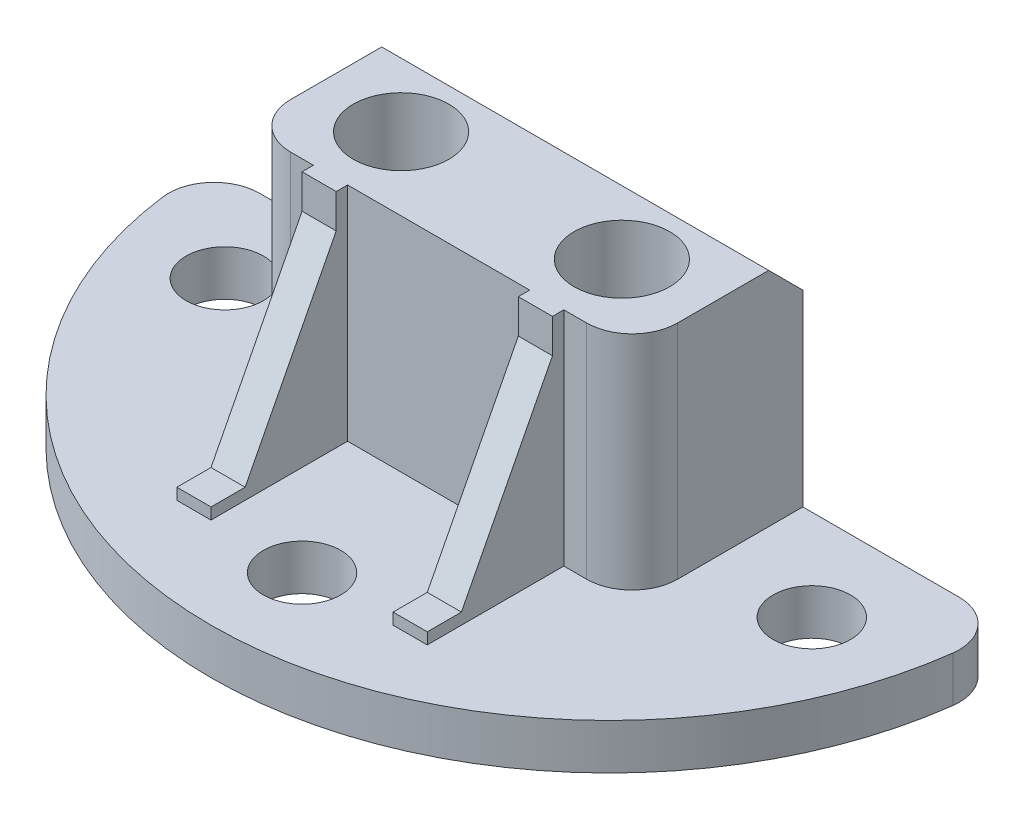
from build123d import *

# Parameters (mm, degrees)
BOSS_EXTRUDE1_DEPTH = 2
SKETCH1_3_W         = 17
SKETCH1_3_H         = 7.5
SKETCH1_3_R         = 2.1
BOSS_EXTRUDE2_DEPTH = 11.75
FILLET1_R           = 2
CHAMFER1_SIZE       = 1.5
SKETCH2_W           = 1.5
SKETCH2_H           = 9.75
BOSS_EXTRUDE3_DEPTH = 6
CUT_EXTRUDE1_DEPTH  = 32.102554433
CUT_EXTRUDE2_START  = 11.75
SKETCH1_4_R         = 2.1
CUT_EXTRUDE2_DEPTH  = 5


with BuildPart() as part:
    # Sketch1 → Boss-Extrude1 (new body)
    with BuildSketch(Plane(origin=(0, 0, 0), x_dir=(1, 0, 0), z_dir=(0, 1, 0))):
        with BuildLine():
            ThreePointArc((13.294270592, -2.34784357), (13.448469299, -1.178419919), (13.5, 0))
            Line((13.5, 0), (8.5, 0))
            Line((8.5, 0), (8.5, -7.5))
            Line((8.5, -7.5), (-8.5, -7.5))
            Line((-8.5, -7.5), (-8.5, 0))
            Line((-8.5, 0), (-13.5, 0))
            ThreePointArc((-13.5, 0), (-13.448469299, -1.178419919), (-13.294270592, -2.34784357))
            ThreePointArc((-13.294270592, -2.34784357), (-11.842798665, -2.663810422), (-11.193796958, -4))
            ThreePointArc((-11.193796958, -4), (-11.494084595, -4.964782515), (-12.288862018, -5.588727075))
            ThreePointArc((-12.288862018, -5.588727075), (-8.007808689, -10.86853256), (-1.696626969, -13.392962963))
            ThreePointArc((-1.696626969, -13.392962963), (0, -11.8), (1.696626969, -13.392962963))
            ThreePointArc((1.696626969, -13.392962963), (8.007808689, -10.86853256), (12.288862018, -5.588727075))
            ThreePointArc((12.288862018, -5.588727075), (11.270133638, -3.496296296), (13.294270592, -2.34784357))
        make_face()
        with BuildLine():
            Line((17.5, 0), (13.5, 0))
            ThreePointArc((13.5, 0), (13.448469299, -1.178419919), (13.294270592, -2.34784357))
            ThreePointArc((13.294270592, -2.34784357), (14.229986536, -2.949001707), (14.593796958, -4))
            ThreePointArc((14.593796958, -4), (13.858579473, -5.399712363), (12.288862018, -5.588727075))
            ThreePointArc((12.288862018, -5.588727075), (8.007808689, -10.86853256), (1.696626969, -13.392962963))
            ThreePointArc((1.696626969, -13.392962963), (1.699156533, -13.446454915), (1.7, -13.5))
            ThreePointArc((1.7, -13.5), (-0.053545085, -15.199156533), (-1.696626969, -13.392962963))
            ThreePointArc((-1.696626969, -13.392962963), (-8.007808689, -10.86853256), (-12.288862018, -5.588727075))
            ThreePointArc((-12.288862018, -5.588727075), (-14.517460279, -4.503703704), (-13.294270592, -2.34784357))
            ThreePointArc((-13.294270592, -2.34784357), (-13.448469299, -1.178419919), (-13.5, 0))
            Line((-13.5, 0), (-17.5, 0))
            ThreePointArc((-17.5, 0), (0, -17.5), (17.5, 0))
        make_face()
    extrude(amount=BOSS_EXTRUDE1_DEPTH)

    # Sketch1<3> → Boss-Extrude2 (add)
    # profile 1 of 3: a face of its own
    with BuildSketch(Plane(origin=(0, 0, 0), x_dir=(1, 0, 0), z_dir=(0, 1, 0))):
        with Locations((0, -3.75)):
            Rectangle(SKETCH1_3_W, SKETCH1_3_H)
        with Locations((-4.85, -4.3)):
            Circle(SKETCH1_3_R, mode=Mode.SUBTRACT)
        with Locations((4.85, -4.3)):
            Circle(SKETCH1_3_R, mode=Mode.SUBTRACT)
    # profile 2 of 3: a face of its own
    with BuildSketch(Plane(origin=(0, 0, 0), x_dir=(1, 0, 0), z_dir=(0, 1, 0))):
        with Locations((-4.85, -4.3)):
            Circle(SKETCH1_3_R)
    # profile 3 of 3: a face of its own
    with BuildSketch(Plane(origin=(0, 0, 0), x_dir=(1, 0, 0), z_dir=(0, 1, 0))):
        with Locations((4.85, -4.3)):
            Circle(SKETCH1_3_R)
    extrude(amount=BOSS_EXTRUDE2_DEPTH)

    # Fillet1
    fillet1_edges = [part.edges().sort_by_distance(p)[0] for p in [
        (-17.5, 1, 0),
        (17.5, 1, 0),
        (8.5, 6.875, 7.5),
        (-8.5, 6.875, 7.5),
    ]]
    fillet(fillet1_edges, radius=FILLET1_R)

    # Chamfer1
    chamfer1_edges = [part.edges().sort_by_distance(p)[0] for p in [
        (0, 11.75, 0),
    ]]
    chamfer(chamfer1_edges, length=CHAMFER1_SIZE)

    # Sketch2 → Boss-Extrude3 (add)
    with BuildSketch(Plane.XY.offset(7.5)):
        with Locations((-4.75, 6.875)):
            Rectangle(SKETCH2_W, SKETCH2_H)
        with Locations((4.75, 6.875)):
            Rectangle(SKETCH2_W, SKETCH2_H)
    extrude(amount=BOSS_EXTRUDE3_DEPTH)

    # Sketch3 → Cut-Extrude1 (cut, through all)
    with BuildSketch(Plane(origin=(5.5, 0, 0), x_dir=(0, 0, -1), z_dir=(1, 0, 0))):
        Polygon((-8, 10.25), (-8, 11.75), (-13.5, 11.75), (-13.5, 2.5), (-12, 2.5), align=None)
    extrude(amount=-CUT_EXTRUDE1_DEPTH, mode=Mode.SUBTRACT)

    # Sketch1<4> → Cut-Extrude2 (cut)
    with BuildSketch(Plane(origin=(0, 0, 0), x_dir=(1, 0, 0), z_dir=(0, 1, 0)).offset(CUT_EXTRUDE2_START)):
        with Locations(Location((-4.85, -4.3, 0), (0, 0, 270))):
            Circle(SKETCH1_4_R)
        with Locations(Location((4.85, -4.3, 0), (0, 0, 270))):
            Circle(SKETCH1_4_R)
    extrude(amount=-CUT_EXTRUDE2_DEPTH, mode=Mode.SUBTRACT)


solid = part.part
